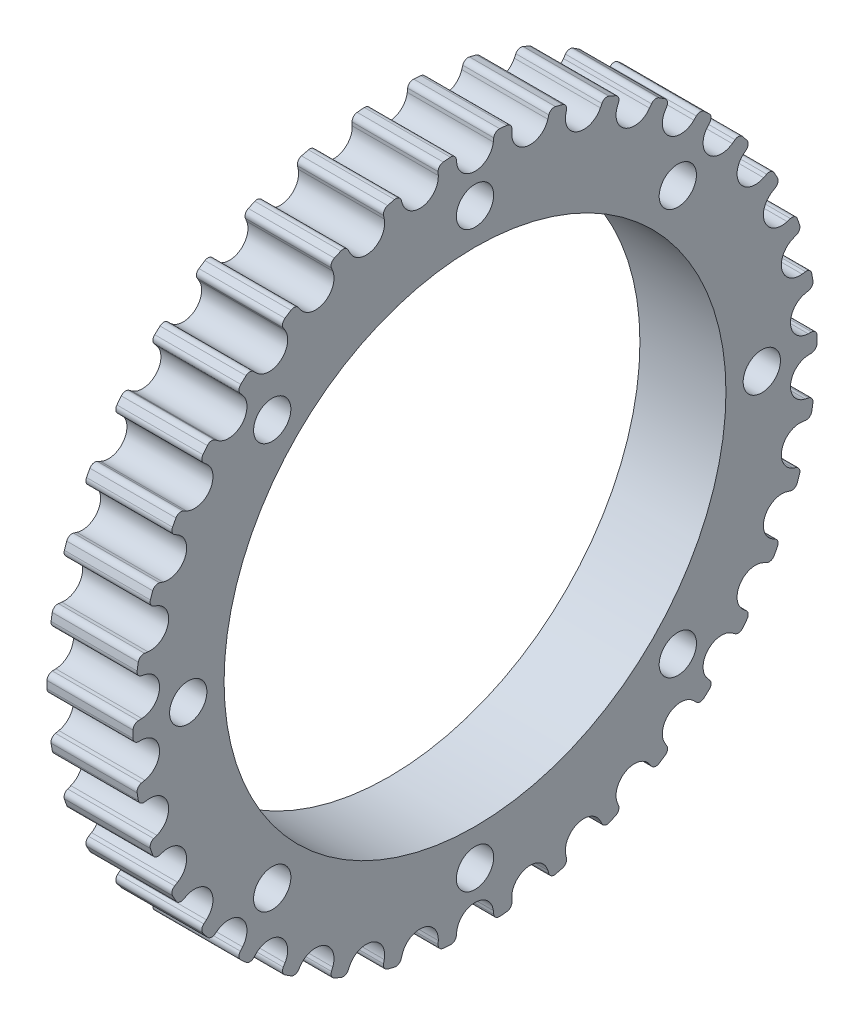
from build123d import *

# Parameters (mm, degrees)
CUT_EXTRUDE_2_REACH      = 75.037
PATTERN_CIRCULAR_3_COUNT = 38
SKETCH_8_R               = 49
CUT_EXTRUDE_4_DEPTH      = 16
SKETCH_9_R               = 35
SKETCH_9_R_2             = 2.6
CUT_EXTRUDE_5_DEPTH      = 20


with BuildPart() as part:
    # 草图1 → 旋转1 (revolve)
    with BuildSketch(Plane.XY, mode=Mode.PRIVATE) as revolve_1_sk:
        Polygon((0, 0), (0, 47.699), (28, 47.699), (28, 22.1356), (20, 22.1356), (20, 0), align=None)
    revolve(revolve_1_sk.sketch.rotate(Axis((0, 0, 0), (1, 0, 0)), 90), axis=Axis((0, 0, 0), (1, 0, 0)))

    # 草图6 → 切除-拉伸2 (cut, up to next)
    with BuildSketch(Plane(origin=(0, 0, 0), x_dir=(0, 0, -1), z_dir=(1, 0, 0)), mode=Mode.PRIVATE) as cut_extrude_2_sk1:
        with BuildLine():
            Line((2.609302062, 46.891901673), (2.55084361, 46.415795787))
            ThreePointArc((2.55084361, 46.415795787), (0, 44.159), (-2.55084361, 46.415795787))
            Line((-2.55084361, 46.415795787), (-2.609302062, 46.891901673))
            ThreePointArc((-2.609302062, 46.891901673), (-2.88805846, 47.399296498), (-3.439736503, 47.574812809))
            ThreePointArc((-3.439736503, 47.574812809), (-3.828606137, 47.545098339), (-4.217219819, 47.512205358))
            Line((-4.217219819, 47.512205358), (-4.413867808, 49.1137747))
            ThreePointArc((-4.413867808, 49.1137747), (0, 49.311713561), (4.413867808, 49.1137747))
            Line((4.413867808, 49.1137747), (4.217219819, 47.512205358))
            ThreePointArc((4.217219819, 47.512205358), (3.828606137, 47.545098339), (3.439736503, 47.574812809))
            ThreePointArc((3.439736503, 47.574812809), (2.88805846, 47.399296498), (2.609302062, 46.891901673))
        make_face()
    cut_extrude_2_tool1 = extrude(cut_extrude_2_sk1.sketch, amount=CUT_EXTRUDE_2_REACH, mode=Mode.PRIVATE) & part.part
    cut_extrude_2 = cut_extrude_2_tool1.solids().sort_by_distance((0, 47.242726, 0))[0]
    add(cut_extrude_2, mode=Mode.SUBTRACT)

    # 阵列(圆周)3: 切除-拉伸2 ×38 about axis
    pattern_circular_3_axis = Axis((0, 0, 0), (1, 0, 0))
    for i in range(1, PATTERN_CIRCULAR_3_COUNT):
        add(cut_extrude_2.rotate(pattern_circular_3_axis, i * 360 / PATTERN_CIRCULAR_3_COUNT), mode=Mode.SUBTRACT)

    # 草图8 → 切除-拉伸4 (cut)
    with BuildSketch(Plane(origin=(28, 0, 0), x_dir=(0, 0, -1), z_dir=(1, 0, 0))):
        Circle(SKETCH_8_R)
    extrude(amount=-CUT_EXTRUDE_4_DEPTH, mode=Mode.SUBTRACT)

    # 草图9 → 切除-拉伸5 (cut)
    with BuildSketch(Plane(origin=(12, 0, 0), x_dir=(0, 0, -1), z_dir=(1, 0, 0))):
        Circle(SKETCH_9_R)
        with Locations((0, 40)):
            Circle(SKETCH_9_R_2)
        with Locations((28.284271247, 28.284271247)):
            Circle(SKETCH_9_R_2)
        with Locations((40, 0)):
            Circle(SKETCH_9_R_2)
        with Locations((28.284271247, -28.284271247)):
            Circle(SKETCH_9_R_2)
        with Locations((0, -40)):
            Circle(SKETCH_9_R_2)
        with Locations((-28.284271247, -28.284271247)):
            Circle(SKETCH_9_R_2)
        with Locations((-40, 0)):
            Circle(SKETCH_9_R_2)
        with Locations((-28.284271247, 28.284271247)):
            Circle(SKETCH_9_R_2)
    extrude(amount=-CUT_EXTRUDE_5_DEPTH, mode=Mode.SUBTRACT)


solid = part.part
